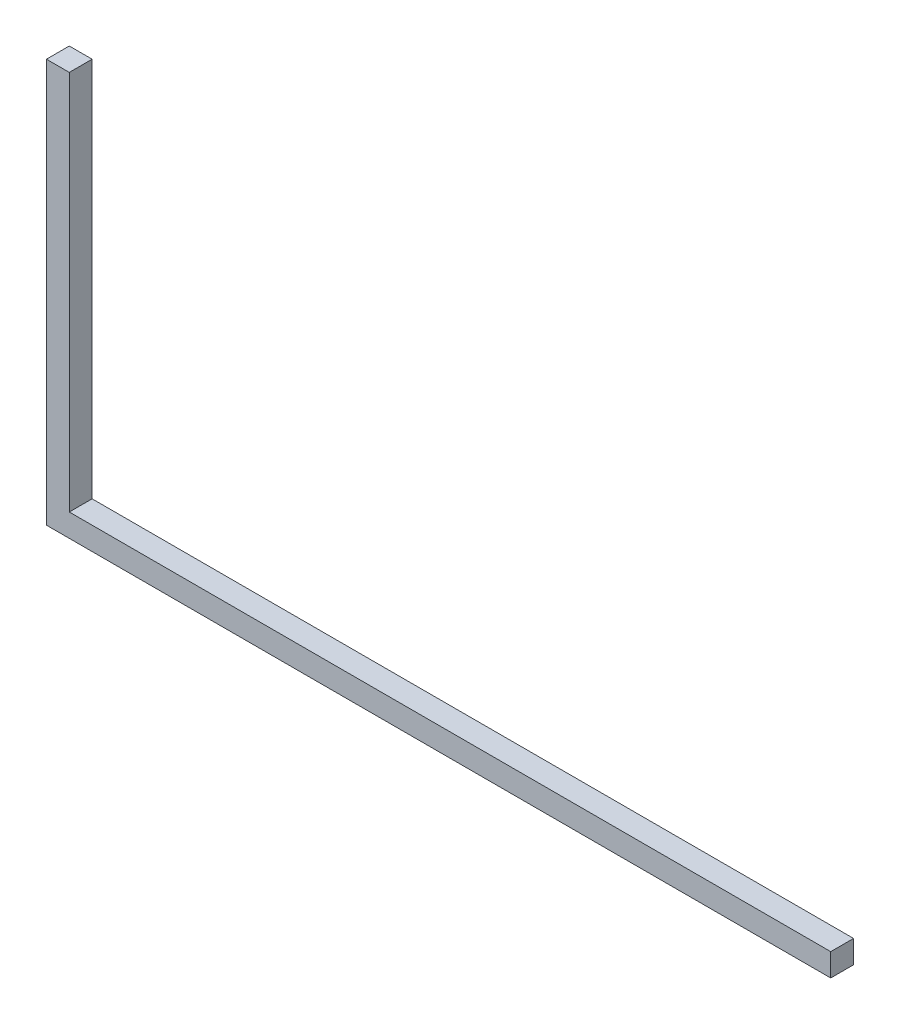
from build123d import *

# Parameters (mm, degrees)
EXTRUDE_1_DEPTH = 15


with BuildPart() as part:
    # 草图1 → 凸台-拉伸1 (new body)
    with BuildSketch(Plane.XY):
        Polygon((0, 0), (0, 250), (-15, 250), (-15, -15), (500, -15), (500, 0), align=None)
    extrude(amount=EXTRUDE_1_DEPTH)


solid = part.part
